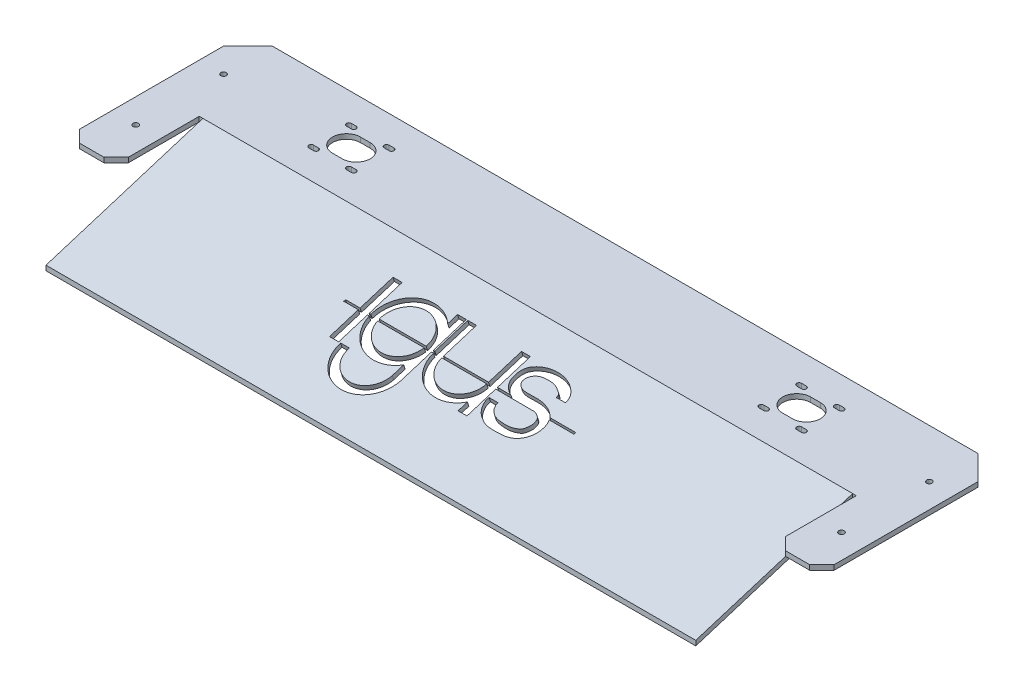
from build123d import *

# Parameters (mm, degrees)
BOSS_EXTRUDE1_DEPTH  = 4
MIRROR6_COPY_1_DEPTH = 4
MIRROR6_COPY_2_DEPTH = 4
SKETCH2_R            = 2.25
CUT_EXTRUDE1_DEPTH   = 44
CHAMFER1_SIZE        = 10
CHAMFER2_SIZE        = 10
SKETCH3_W            = 4.89133335
SKETCH3_H            = 7.534428505
SKETCH3_W_2          = 4.722258617
SKETCH3_W_3          = 4.986234694
SKETCH3_R            = 2.398576227
CUT_EXTRUDE2_DEPTH   = 10
CUT_EXTRUDE3_DEPTH   = 10
BOSS_EXTRUDE2_DEPTH  = 267
CUT_EXTRUDE4_DEPTH   = 494
SKETCH8_W            = 234.885891169
SKETCH8_H            = 80
BOSS_EXTRUDE3_DEPTH  = 4
SKETCH9_W            = 791.232351343
SKETCH9_H            = 194.819885891
CUT_EXTRUDE5_DEPTH   = 139
CHAMFER3_SIZE        = 20


with BuildPart() as part:
    # Sketch1 → Boss-Extrude1 (new body)
    with BuildSketch(Plane(origin=(0, 0, 0), x_dir=(1, 0, 0), z_dir=(0, 1, 0))):
        with BuildLine():
            Line((-310, 108.284271247), (-310, 0))
            Line((-310, 0), (-200.5, 0))
            ThreePointArc((-200.5, 0), (-197.131727984, 8.131727984), (-189, 11.5))
            Line((-189, 11.5), (-181, 11.5))
            ThreePointArc((-181, 11.5), (-172.868272016, 8.131727984), (-169.5, 0))
            Line((-169.5, 0), (0, 0))
            Line((0, 0), (0, 40))
            Line((0, 40), (-241.715728753, 40))
            Line((-241.715728753, 40), (-270, 68.284271247))
            Line((-270, 68.284271247), (-270, 108.284271247))
            Line((-270, 108.284271247), (-310, 108.284271247))
        make_face()
        with BuildLine():
            ThreePointArc((-202.499780644, 13.499780644), (-204.499780644, 15.499780644), (-202.499780644, 17.499780644))
            Line((-202.499780644, 17.499780644), (-198.499780644, 17.499780644))
            ThreePointArc((-198.499780644, 17.499780644), (-196.499780644, 15.499780644), (-198.499780644, 13.499780644))
            Line((-198.499780644, 13.499780644), (-202.499780644, 13.499780644))
        make_face(mode=Mode.SUBTRACT)
        with BuildLine():
            Line((-171.500219356, 17.499780644), (-167.500219356, 17.499780644))
            ThreePointArc((-167.500219356, 17.499780644), (-165.500219356, 15.499780644), (-167.500219356, 13.499780644))
            Line((-167.500219356, 13.499780644), (-171.500219356, 13.499780644))
            ThreePointArc((-171.500219356, 13.499780644), (-173.500219356, 15.499780644), (-171.500219356, 17.499780644))
        make_face(mode=Mode.SUBTRACT)
    boss_extrude1 = extrude(amount=BOSS_EXTRUDE1_DEPTH)

    # Mirror1: Boss-Extrude1 across plane
    add(boss_extrude1.mirror(Plane(origin=(0, 4, 0), x_dir=(1, 0, 0), z_dir=(0, 0, -1))))

    # Mirror5: Boss-Extrude1 across plane
    add(boss_extrude1.mirror(Plane(origin=(0, 4, 0), x_dir=(0, 0, 1), z_dir=(1, 0, 0))))

    # Mirror6 copy 1 sketch → Mirror6 copy 1 (add)
    with BuildSketch(Plane(origin=(0, 0, 0), x_dir=(-1, 0, 0), z_dir=(0, 1, 0))):
        with BuildLine():
            Line((-310, 108.284271247), (-310, 0))
            Line((-310, 0), (-200.5, 0))
            ThreePointArc((-200.5, 0), (-197.131727984, 8.131727984), (-189, 11.5))
            Line((-189, 11.5), (-181, 11.5))
            ThreePointArc((-181, 11.5), (-172.868272016, 8.131727984), (-169.5, 0))
            Line((-169.5, 0), (0, 0))
            Line((0, 0), (0, 40))
            Line((0, 40), (-241.715728753, 40))
            Line((-241.715728753, 40), (-270, 68.284271247))
            Line((-270, 68.284271247), (-270, 108.284271247))
            Line((-270, 108.284271247), (-310, 108.284271247))
        make_face()
        with BuildLine():
            ThreePointArc((-202.499780644, 13.499780644), (-204.499780644, 15.499780644), (-202.499780644, 17.499780644))
            Line((-202.499780644, 17.499780644), (-198.499780644, 17.499780644))
            ThreePointArc((-198.499780644, 17.499780644), (-196.499780644, 15.499780644), (-198.499780644, 13.499780644))
            Line((-198.499780644, 13.499780644), (-202.499780644, 13.499780644))
        make_face(mode=Mode.SUBTRACT)
        with BuildLine():
            Line((-171.500219356, 17.499780644), (-167.500219356, 17.499780644))
            ThreePointArc((-167.500219356, 17.499780644), (-165.500219356, 15.499780644), (-167.500219356, 13.499780644))
            Line((-167.500219356, 13.499780644), (-171.500219356, 13.499780644))
            ThreePointArc((-171.500219356, 13.499780644), (-173.500219356, 15.499780644), (-171.500219356, 17.499780644))
        make_face(mode=Mode.SUBTRACT)
    extrude(amount=MIRROR6_COPY_1_DEPTH)

    # Mirror6 copy 2 sketch → Mirror6 copy 2 (add)
    with BuildSketch(Plane(origin=(0, 0, 0), x_dir=(1, 0, 0), z_dir=(0, 1, 0))):
        with BuildLine():
            Line((-310, -108.284271247), (-310, 0))
            Line((-310, 0), (-200.5, 0))
            ThreePointArc((-200.5, 0), (-197.131727984, -8.131727984), (-189, -11.5))
            Line((-189, -11.5), (-181, -11.5))
            ThreePointArc((-181, -11.5), (-172.868272016, -8.131727984), (-169.5, 0))
            Line((-169.5, 0), (0, 0))
            Line((0, 0), (0, -40))
            Line((0, -40), (-241.715728753, -40))
            Line((-241.715728753, -40), (-270, -68.284271247))
            Line((-270, -68.284271247), (-270, -108.284271247))
            Line((-270, -108.284271247), (-310, -108.284271247))
        make_face()
        with BuildLine():
            ThreePointArc((-202.499780644, -13.499780644), (-204.499780644, -15.499780644), (-202.499780644, -17.499780644))
            Line((-202.499780644, -17.499780644), (-198.499780644, -17.499780644))
            ThreePointArc((-198.499780644, -17.499780644), (-196.499780644, -15.499780644), (-198.499780644, -13.499780644))
            Line((-198.499780644, -13.499780644), (-202.499780644, -13.499780644))
        make_face(mode=Mode.SUBTRACT)
        with BuildLine():
            Line((-171.500219356, -17.499780644), (-167.500219356, -17.499780644))
            ThreePointArc((-167.500219356, -17.499780644), (-165.500219356, -15.499780644), (-167.500219356, -13.499780644))
            Line((-167.500219356, -13.499780644), (-171.500219356, -13.499780644))
            ThreePointArc((-171.500219356, -13.499780644), (-173.500219356, -15.499780644), (-171.500219356, -17.499780644))
        make_face(mode=Mode.SUBTRACT)
    extrude(amount=MIRROR6_COPY_2_DEPTH)

    # Sketch2 → Cut-Extrude1 (cut)
    with BuildSketch(Plane(origin=(0, 4, 0), x_dir=(1, 0, 0), z_dir=(0, 1, 0))):
        with BuildLine():
            ThreePointArc((-287.75, -72.189514165), (-288.409009742, -70.598523907), (-290, -69.939514165))
            Line((-290, -69.939514165), (-290, -72.189514165))
            Line((-290, -72.189514165), (-290, -74.439514165))
            ThreePointArc((-290, -74.439514165), (-288.409009742, -73.780504423), (-287.75, -72.189514165))
        make_face()
        with BuildLine():
            Line((-290, -72.189514165), (-290, -69.939514165))
            ThreePointArc((-290, -69.939514165), (-292.25, -72.189514165), (-290, -74.439514165))
            Line((-290, -74.439514165), (-290, -72.189514165))
        make_face()
        with Locations(Location((-290, 0, 0), (0, 0, 270))):
            Circle(SKETCH2_R)
        with BuildLine():
            ThreePointArc((-290, 74.439514165), (-292.25, 72.189514165), (-290, 69.939514165))
            Line((-290, 69.939514165), (-290, 72.189514165))
            Line((-290, 72.189514165), (-290, 74.439514165))
        make_face()
        with BuildLine():
            Line((-290, 72.189514165), (-290, 69.939514165))
            ThreePointArc((-290, 69.939514165), (-288.409009742, 70.598523907), (-287.75, 72.189514165))
            ThreePointArc((-287.75, 72.189514165), (-288.409009742, 73.780504423), (-290, 74.439514165))
            Line((-290, 74.439514165), (-290, 72.189514165))
        make_face()
    cut_extrude1 = extrude(amount=-CUT_EXTRUDE1_DEPTH, mode=Mode.SUBTRACT)

    # Chamfer1
    chamfer1_edges = [part.edges().sort_by_distance(p)[0] for p in [
        (-310, 2, -108.284271247),
        (-270, 2, -108.284271247),
        (-310, 2, 108.284271247),
        (-270, 2, 108.284271247),
    ]]
    chamfer(chamfer1_edges, length=CHAMFER1_SIZE)

    # Mirror9: Cut-Extrude1 across plane
    add(cut_extrude1.mirror(Plane(origin=(0, 0, 0), x_dir=(0, 0, 1), z_dir=(1, 0, 0))), mode=Mode.SUBTRACT)

    # Chamfer2
    chamfer2_edges = [part.edges().sort_by_distance(p)[0] for p in [
        (310, 2, -108.284271247),
        (270, 2, -108.284271247),
        (270, 2, 108.284271247),
        (310, 2, 108.284271247),
    ]]
    chamfer(chamfer2_edges, length=CHAMFER2_SIZE)

    # Sketch3 → Cut-Extrude2 (cut)
    # profile 1 of 9: a face of its own
    with BuildSketch(Plane(origin=(0, 4, 0), x_dir=(1, 0, 0), z_dir=(0, 1, 0))):
        with BuildLine():
            Line((17.756292578, 19.05072103), (13.034033961, 19.05072103))
            Line((13.034033961, 19.05072103), (13.034033961, 7.690043412))
            Line((13.034033961, 7.690043412), (12.186922475, 7.690043412))
            Line((12.186922475, 7.690043412), (12.186922475, 6.673634872))
            Line((12.186922475, 6.673634872), (13.225704841, 6.673634872))
            ThreePointArc((13.225704841, 6.673634872), (24.116047648, -8.695675291), (42.460223463, -4.417068623))
            Line((42.460223463, -4.417068623), (42.460223463, -9.82377172))
            Line((42.460223463, -9.82377172), (47.351556813, -9.82377172))
            Line((47.351556813, -9.82377172), (47.351556813, 6.673634872))
            Line((47.351556813, 6.673634872), (69.025260991, 6.577857233))
            add(Edge.make_bspline(
                [(53.065115514, 1.992023577), (52.881837045, 1.062447323), (53.465286783, -0.024014), (54.104109076, -1.49188122), (54.980355207, -2.267471592), (55.990558487, -3.253822675), (57.452703304, -4.003429754), (59.394774923, -4.52432428), (61.614526466, -4.708300775), (64.133123091, -4.769461908), (66.61763139, -4.538941365), (68.828544546, -3.78251384), (70.965531795, -2.816690556), (71.985481287, -0.789058617), (72.789638663, 1.157030101), (72.696348399, 3.064497119), (72.029797832, 5.473319111), (69.935664737, 6.048250566), (69.025260991, 6.577857233)],
                knots=[0, 0, 0, 0, 0.081184108, 0.10790483, 0.143900876, 0.185103716, 0.23586594, 0.290215762, 0.366526158, 0.436729253, 0.51873906, 0.590001951, 0.649430214, 0.723575416, 0.786665555, 0.838093389, 0.894821875, 1, 1, 1, 1], degree=3))
            Line((53.065115514, 1.992023577), (48.176767212, 1.992023577))
            add(Edge.make_bspline(
                [(76.689802119, 6.673634872), (76.776720841, 6.515309476), (77.346082491, 5.379089539), (77.842385043, 2.775098219), (77.495708471, -0.969732888), (75.84192986, -4.323913716), (73.376942523, -6.987464077), (70.475703458, -8.580791803), (67.383864983, -9.28319435), (63.916433002, -9.449948165), (60.249662271, -9.506502989), (56.621049626, -9.147945731), (53.7606345, -7.582775153), (51.081460509, -5.941045539), (48.808288636, -2.537264498), (47.91057008, 0.166586441), (48.176767212, 1.992023577)],
                knots=[0.511379909, 0.511379909, 0.511379909, 0.511379909, 0.516990878, 0.550897762, 0.592186626, 0.63231135, 0.665073685, 0.704086852, 0.733344431, 0.763283971, 0.812029986, 0.848328531, 0.874618577, 0.91298076, 0.944693495, 1, 1, 1, 1], degree=3))
            Line((76.689802119, 6.673634872), (82.483953867, 6.673634872))
            Line((82.483953867, 6.673634872), (82.483953867, 7.690043412))
            Line((82.483953867, 7.690043412), (76.019711163, 7.690043412))
            add(Edge.make_bspline(
                [(54.711643622, 19.05072103), (54.228336507, 18.492948034), (53.432038562, 17.131039988), (53.374474987, 14.851467964), (54.797016983, 13.113774771), (58.599264933, 11.576030604), (64.211750858, 12.572849086), (70.285584626, 11.558006557), (74.079668595, 9.742953229), (75.581729127, 8.253961347), (76.019711163, 7.690043412)],
                knots=[0.197684265, 0.197684265, 0.197684265, 0.197684265, 0.220521746, 0.245718615, 0.26280001, 0.287259547, 0.369622478, 0.434467432, 0.476788021, 0.498807658, 0.498807658, 0.498807658, 0.498807658], degree=3))
            Line((54.711643622, 19.05072103), (49.132787671, 19.05072103))
            add(Edge.make_bspline(
                [(49.132787671, 19.05072103), (48.839053253, 17.885586508), (48.737005594, 15.70465507), (49.393762237, 11.111054491), (52.39797666, 8.519920076), (54.705573707, 7.690043412)],
                knots=[0.713647859, 0.713647859, 0.713647859, 0.713647859, 0.787926735, 0.842679623, 1, 1, 1, 1], degree=3))
            Line((54.705573707, 7.690043412), (47.351556813, 7.690043412))
            Line((47.351556813, 7.690043412), (47.351556813, 19.05072103))
            Line((47.351556813, 19.05072103), (42.460223463, 19.05072103))
            Line((42.460223463, 19.05072103), (42.460223463, 7.690043412))
            Line((42.460223463, 7.690043412), (17.756292578, 7.690043412))
            Line((17.756292578, 7.690043412), (17.756292578, 19.05072103))
        make_face()
        with BuildLine():
            ThreePointArc((42.453173513, 6.673634872), (30.105024404, -5.264242546), (17.756875295, 6.673634872))
            Line((17.756875295, 6.673634872), (42.453173513, 6.673634872))
        make_face(mode=Mode.SUBTRACT)
    # profile 2 of 9: a face of its own
    with BuildSketch(Plane(origin=(0, 4, 0), x_dir=(1, 0, 0), z_dir=(0, 1, 0))):
        with BuildLine():
            Line((-22.946213844, 19.05072103), (-27.932448538, 19.05072103))
            Line((-27.932448538, 19.05072103), (-27.932448538, 7.690043412))
            Line((-27.932448538, 7.690043412), (-35.931837929, 7.690043412))
            Line((-35.931837929, 7.690043412), (-35.931837929, 6.673634872))
            Line((-35.931837929, 6.673634872), (-27.932448538, 6.673634872))
            Line((-27.932448538, 6.673634872), (-27.932448538, -9.82377172))
            Line((-27.932448538, -9.82377172), (-22.946213844, -9.82377172))
            Line((-22.946213844, -9.82377172), (-22.946213844, 6.673634872))
            Line((-22.946213844, 6.673634872), (-21.948820324, 6.673634872))
            ThreePointArc((-21.948820324, 6.673634872), (-10.703931008, -8.020841554), (7.425571711, -4.319989716))
            Line((7.425571711, -4.319989716), (7.425571711, -10.878511442))
            ThreePointArc((7.425571711, -10.878511442), (-5.357108304, -22.606451736), (-17.085048598, -9.82377172))
            Line((-17.085048598, -9.82377172), (-21.846399362, -9.82377172))
            ThreePointArc((-21.846399362, -9.82377172), (-5.357108304, -27.3678025), (12.186922475, -10.878511442))
            Line((12.186922475, -10.878511442), (12.186922475, 6.673634872))
            Line((12.186922475, 6.673634872), (12.186922475, 7.690043412))
            Line((12.186922475, 7.690043412), (12.186922475, 19.05072103))
            Line((12.186922475, 19.05072103), (2.513227227, 19.05072103))
            ThreePointArc((2.513227227, 19.05072103), (6.896441183, 14.132295136), (8.275161815, 7.690043412))
            Line((8.275161815, 7.690043412), (-17.463188566, 7.690043412))
            ThreePointArc((-17.463188566, 7.690043412), (-16.084467934, 14.132295136), (-11.701253978, 19.05072103))
            Line((-11.701253978, 19.05072103), (-18.318763594, 19.05072103))
            ThreePointArc((-18.318763594, 19.05072103), (-21.170258302, 13.696875268), (-22.01444878, 7.690043412))
            Line((-22.01444878, 7.690043412), (-22.946213844, 7.690043412))
            Line((-22.946213844, 7.690043412), (-22.946213844, 19.05072103))
        make_face()
        with BuildLine():
            ThreePointArc((8.186183206, 6.673634872), (-4.594013375, -4.579297807), (-17.374209956, 6.673634872))
            Line((-17.374209956, 6.673634872), (8.186183206, 6.673634872))
        make_face(mode=Mode.SUBTRACT)
    # profile 3 of 9: a face of its own
    with BuildSketch(Plane(origin=(0, 4, 0), x_dir=(1, 0, 0), z_dir=(0, 1, 0))):
        with BuildLine():
            add(Edge.make_bspline(
                [(75.926908033, 16.711887446), (75.98198398, 17.533071739), (75.87815744, 18.314387372), (75.647457481, 19.05072103)],
                knots=[0, 0, 0, 0, 0.048614378, 0.048614378, 0.048614378, 0.048614378], degree=3))
            Line((75.647457481, 19.05072103), (69.828511328, 19.05072103))
            add(Edge.make_bspline(
                [(70.902358123, 16.711887446), (71.166450288, 17.527072406), (70.619011269, 18.36228737), (69.932996585, 18.965212767), (69.828511328, 19.05072103)],
                knots=[0, 0, 0, 0, 0.023973978, 0.028160225, 0.028160225, 0.028160225, 0.028160225], degree=3))
            Line((70.902358123, 16.711887446), (75.926908033, 16.711887446))
        make_face()
    # profile 4 of 9: a face of its own
    with BuildSketch(Plane(origin=(0, 4, 0), x_dir=(1, 0, 0), z_dir=(0, 1, 0))):
        with BuildLine():
            add(Edge.make_bspline(
                [(75.647457481, 19.05072103), (74.8610236, 21.560811367), (70.159759986, 25.693522362), (61.769498524, 27.189063275), (54.345606328, 25.369162718), (50.102002584, 21.86707642), (49.281229323, 19.639533517), (49.132787671, 19.05072103)],
                knots=[0.048614378, 0.048614378, 0.048614378, 0.048614378, 0.214336098, 0.393230308, 0.565847142, 0.676110279, 0.713647859, 0.713647859, 0.713647859, 0.713647859], degree=3))
            Line((49.132787671, 19.05072103), (54.711643622, 19.05072103))
            add(Edge.make_bspline(
                [(69.828511328, 19.05072103), (69.460610839, 19.351802088), (68.44441553, 19.988567659), (66.290510676, 21.191963116), (63.448419319, 21.636606986), (60.184054731, 21.526555102), (57.263617202, 21.092430186), (55.428580667, 19.838629095), (54.781454546, 19.131288121), (54.711643622, 19.05072103)],
                knots=[0.028160225, 0.028160225, 0.028160225, 0.028160225, 0.04290032, 0.065706797, 0.10450496, 0.130316026, 0.168033853, 0.194385522, 0.197684265, 0.197684265, 0.197684265, 0.197684265], degree=3))
            Line((69.828511328, 19.05072103), (75.647457481, 19.05072103))
        make_face()
    # profile 5 of 9: a face of its own
    with BuildSketch(Plane(origin=(0, 4, 0), x_dir=(1, 0, 0), z_dir=(0, 1, 0))):
        with Locations((44.905890138, 22.817935283)):
            Rectangle(SKETCH3_W, SKETCH3_H)
    # profile 6 of 9: a face of its own
    with BuildSketch(Plane(origin=(0, 4, 0), x_dir=(1, 0, 0), z_dir=(0, 1, 0))):
        with Locations((15.395163269, 22.817935283)):
            Rectangle(SKETCH3_W_2, SKETCH3_H)
    # profile 7 of 9: a face of its own
    with BuildSketch(Plane(origin=(0, 4, 0), x_dir=(1, 0, 0), z_dir=(0, 1, 0))):
        with BuildLine():
            ThreePointArc((7.425571711, 20.929069677), (-5.862455507, 25.689597653), (-18.318763594, 19.05072103))
            Line((-18.318763594, 19.05072103), (-11.701253978, 19.05072103))
            ThreePointArc((-11.701253978, 19.05072103), (-4.594013375, 21.188377767), (2.513227227, 19.05072103))
            Line((2.513227227, 19.05072103), (12.186922475, 19.05072103))
            Line((12.186922475, 19.05072103), (12.186922475, 26.585149535))
            Line((12.186922475, 26.585149535), (7.425571711, 26.585149535))
            Line((7.425571711, 26.585149535), (7.425571711, 20.929069677))
        make_face()
    # profile 8 of 9: a face of its own
    with BuildSketch(Plane(origin=(0, 4, 0), x_dir=(1, 0, 0), z_dir=(0, 1, 0))):
        with Locations((-25.439331191, 22.817935283)):
            Rectangle(SKETCH3_W_3, SKETCH3_H)
    # profile 9 of 9: a face of its own
    with BuildSketch(Plane(origin=(0, 4, 0), x_dir=(1, 0, 0), z_dir=(0, 1, 0))):
        with Locations(Location((-25.580451041, 32.418103328, 0), (0, 0, 270))):
            Circle(SKETCH3_R)
    extrude(amount=-CUT_EXTRUDE2_DEPTH, mode=Mode.SUBTRACT)


with BuildPart() as cut_extrude2_piece_1:
    # of the separate pieces the step leaves, piece 1, a body of its own (cut_extrude2_pieces)
    add(part.part.solids().sort_by_distance((270, 0, -98.284271247))[0])

    # Sketch5 → Cut-Extrude3 (cut)
    with BuildSketch(Plane(origin=(0, 4, 0), x_dir=(1, 0, 0), z_dir=(0, 1, 0))):
        Polygon((-270, -68.284271247), (-241.715728753, -40), (-270, -40), align=None)
        Polygon((241.715728753, -40), (270, -68.284271247), (270, -40), align=None)
    extrude(amount=-CUT_EXTRUDE3_DEPTH, mode=Mode.SUBTRACT)

    # Sketch6 → Boss-Extrude2 (add, symmetric)
    with BuildSketch(Plane(origin=(0, 0, 0), x_dir=(0, 0, -1), z_dir=(1, 0, 0))):
        Polygon((-40, 4), (-168.937969582, -36), (-168.937969582, -40), (-40, 0), align=None)
    extrude(amount=BOSS_EXTRUDE2_DEPTH, both=True)

    # Sketch7 → Cut-Extrude4 (cut)
    # profile 1 of 2: a face of its own
    with BuildSketch(Plane(origin=(0, 14.968491157, 4.643625522), x_dir=(1, 0, 0), z_dir=(0, 0.9550960709798243, 0.29629629629629645))):
        with BuildLine():
            Line((-76.620361052, -94.775659486), (-75.124270772, -94.775659486))
            ThreePointArc((-75.124270772, -94.775659486), (-58.256936797, -116.817374125), (-31.062682719, -111.266096368))
            Line((-31.062682719, -111.266096368), (-31.062682719, -121.103878957))
            ThreePointArc((-31.062682719, -121.103878957), (-50.236702742, -138.695789398), (-67.828613183, -119.521769375))
            Line((-67.828613183, -119.521769375), (-74.970639329, -119.521769375))
            ThreePointArc((-74.970639329, -119.521769375), (-50.236702742, -145.837815544), (-23.920656573, -121.103878957))
            Line((-23.920656573, -121.103878957), (-23.920656573, -64.908387492))
            Line((-23.920656573, -64.908387492), (-31.062682719, -64.908387492))
            Line((-31.062682719, -64.908387492), (-31.062682719, -73.392507279))
            ThreePointArc((-31.062682719, -73.392507279), (-59.815775322, -68.482654627), (-75.222713455, -93.251046677))
            Line((-75.222713455, -93.251046677), (-76.620361052, -93.251046677))
            Line((-76.620361052, -93.251046677), (-76.620361052, -64.908387491))
            Line((-76.620361052, -64.908387491), (-84.099713093, -64.908387491))
            Line((-84.099713093, -64.908387491), (-84.099713093, -93.251046677))
            Line((-84.099713093, -93.251046677), (-96.098797179, -93.251046677))
            Line((-96.098797179, -93.251046677), (-96.098797179, -94.775659486))
            Line((-96.098797179, -94.775659486), (-84.099713093, -94.775659486))
            Line((-84.099713093, -94.775659486), (-84.099713093, -119.521769375))
            Line((-84.099713093, -119.521769375), (-76.620361052, -119.521769375))
            Line((-76.620361052, -119.521769375), (-76.620361052, -94.775659486))
        make_face()
        with BuildLine():
            ThreePointArc((-29.788297563, -93.251046677), (-49.092060349, -73.003545143), (-68.395823135, -93.251046677))
            Line((-68.395823135, -93.251046677), (-29.788297563, -93.251046677))
        make_face(mode=Mode.SUBTRACT)
        with BuildLine():
            ThreePointArc((-68.26235522, -94.775659486), (-49.092060349, -111.655058504), (-29.921765477, -94.775659486))
            Line((-29.921765477, -94.775659486), (-68.26235522, -94.775659486))
        make_face(mode=Mode.SUBTRACT)
    # profile 2 of 2: a face of its own
    with BuildSketch(Plane(origin=(0, 14.968491157, 4.643625522), x_dir=(1, 0, 0), z_dir=(0, 0.9550960709798243, 0.29629629629629645))):
        with BuildLine():
            Line((-23.920656573, -93.251046677), (-23.920656573, -94.775659486))
            Line((-23.920656573, -94.775659486), (-22.362483025, -94.775659486))
            ThreePointArc((-22.362483025, -94.775659486), (-6.026968814, -117.829624731), (21.489294908, -111.411714729))
            Line((21.489294908, -111.411714729), (21.489294908, -119.521769375))
            Line((21.489294908, -119.521769375), (28.826294934, -119.521769375))
            Line((28.826294934, -119.521769375), (28.826294934, -94.775659487))
            Line((28.826294934, -94.775659487), (61.3368512, -94.919325946))
            add(Edge.make_bspline(
                [(37.396632985, -101.798076429), (37.121715281, -103.19244081), (37.996889889, -104.822132794), (38.955123328, -107.023933625), (40.269492526, -108.187319182), (41.784797445, -109.666845807), (43.978014671, -110.791256425), (46.891122099, -111.572598214), (50.220749413, -111.848562957), (53.99864435, -111.940304656), (57.7254068, -111.594523842), (61.041776534, -110.459882554), (64.247257408, -109.011147629), (65.777181645, -105.969699719), (66.983417709, -103.050566642), (66.843482312, -100.189366116), (65.843656462, -96.576133129), (62.70245682, -95.713735945), (61.3368512, -94.919325946)],
                knots=[0, 0, 0, 0, 0.081184108, 0.10790483, 0.143900876, 0.185103716, 0.23586594, 0.290215762, 0.366526158, 0.436729253, 0.51873906, 0.590001951, 0.649430214, 0.723575416, 0.786665555, 0.838093389, 0.894821875, 1, 1, 1, 1], degree=3))
            Line((37.396632985, -101.798076429), (30.064110533, -101.798076429))
            add(Edge.make_bspline(
                [(72.833662893, -94.775659486), (72.964040976, -95.013147581), (73.818083451, -96.717477486), (74.56253728, -100.623464466), (74.042522421, -106.240711126), (71.561854504, -111.271982369), (67.864373499, -115.26730791), (63.512514902, -117.657299499), (58.874757189, -118.71090332), (53.673609218, -118.961034042), (48.17345312, -119.045866279), (42.730534153, -118.508030392), (38.439911464, -116.160274525), (34.421150478, -113.697680102), (31.011392668, -108.592008542), (29.664814834, -104.536232133), (30.064110533, -101.798076429)],
                knots=[0.511379909, 0.511379909, 0.511379909, 0.511379909, 0.516990878, 0.550897762, 0.592186626, 0.63231135, 0.665073685, 0.704086852, 0.733344431, 0.763283971, 0.812029986, 0.848328531, 0.874618577, 0.91298076, 0.944693495, 1, 1, 1, 1], degree=3))
            Line((72.833662893, -94.775659486), (93.142300858, -94.775659486))
            Line((93.142300858, -94.775659486), (93.142300858, -93.251046677))
            Line((93.142300858, -93.251046677), (71.828526459, -93.251046677))
            add(Edge.make_bspline(
                [(64.152496899, -79.718280625), (64.548635146, -78.495503186), (63.297652127, -76.586907522), (60.642742168, -74.902239853), (57.234725728, -72.99816712), (52.971588693, -72.331201315), (48.075041811, -72.496279142), (43.694385517, -73.147466516), (40.008729011, -75.665716185), (37.951391785, -78.916328253), (37.860672194, -82.508909849), (39.994485189, -85.115449637), (45.697857114, -87.422065889), (54.116586002, -85.926838165), (63.227336653, -87.449101958), (68.918462607, -90.171681951), (71.171553404, -92.405169774), (71.828526459, -93.251046677)],
                knots=[0, 0, 0, 0, 0.023973978, 0.04290032, 0.065706797, 0.10450496, 0.130316026, 0.168033853, 0.194385522, 0.220521746, 0.245718615, 0.26280001, 0.287259547, 0.369622478, 0.434467432, 0.476788021, 0.498807658, 0.498807658, 0.498807658, 0.498807658], degree=3))
            Line((64.152496899, -79.718280625), (71.689321764, -79.718280625))
            add(Edge.make_bspline(
                [(71.689321764, -79.718280625), (72.053558559, -74.287497246), (64.221492684, -66.456675657), (50.453207501, -64.002516883), (39.317369206, -66.732367717), (31.476341618, -73.203272387), (30.775327872, -80.325874297), (31.889603071, -88.119530058), (36.395924704, -92.00623168), (39.857320275, -93.251046677)],
                knots=[0, 0, 0, 0, 0.214336098, 0.393230308, 0.565847142, 0.676110279, 0.787926735, 0.842679623, 1, 1, 1, 1], degree=3))
            Line((39.857320275, -93.251046677), (28.826294934, -93.251046677))
            Line((28.826294934, -93.251046677), (28.826294934, -64.908387491))
            Line((28.826294934, -64.908387491), (21.489294908, -64.908387491))
            Line((21.489294908, -64.908387491), (21.489294908, -93.251046677))
            Line((21.489294908, -93.251046677), (-15.566601419, -93.251046677))
            Line((-15.566601419, -93.251046677), (-15.566601419, -64.908387492))
            Line((-15.566601419, -64.908387492), (-22.649989344, -64.908387492))
            Line((-22.649989344, -64.908387492), (-22.649989344, -93.251046677))
            Line((-22.649989344, -93.251046677), (-23.920656573, -93.251046677))
        make_face()
        with BuildLine():
            ThreePointArc((21.478719984, -94.775659486), (2.956496321, -112.682475613), (-15.565727342, -94.775659486))
            Line((-15.565727342, -94.775659486), (21.478719984, -94.775659486))
        make_face(mode=Mode.SUBTRACT)
    extrude(amount=-CUT_EXTRUDE4_DEPTH, mode=Mode.SUBTRACT)


with BuildPart() as cut_extrude2_piece_2:
    # of the separate pieces the step leaves, piece 2, a body of its own (cut_extrude2_pieces)
    add(part.part.solids().sort_by_distance((8.275161815, 0, -7.690043412))[0])



with BuildPart() as cut_extrude2_piece_3:
    # of the separate pieces the step leaves, piece 3, a body of its own (cut_extrude2_pieces)
    add(part.part.solids().sort_by_distance((17.756875295, 0, -6.673634872))[0])


with BuildPart() as cut_extrude2_piece_4:
    # of the separate pieces the step leaves, piece 4, a body of its own (cut_extrude2_pieces)
    add(part.part.solids().sort_by_distance((-17.374209956, 0, -6.673634872))[0])


with BuildPart() as cut_extrude4_piece_1:
    # of the separate pieces the step leaves, piece 1, a body of its own (cut_extrude4_pieces)
    add(cut_extrude2_piece_1.part.solids().sort_by_distance((270, 0, -98.284271247))[0])


with BuildPart() as cut_extrude4_piece_2:
    # of the separate pieces the step leaves, piece 2, a body of its own (cut_extrude4_pieces)
    add(cut_extrude2_piece_1.part.solids().sort_by_distance((-29.788297563, -16.310282619, 92.575368104))[0])


with BuildPart() as cut_extrude4_piece_3:
    # of the separate pieces the step leaves, piece 3, a body of its own (cut_extrude4_pieces)
    add(cut_extrude2_piece_1.part.solids().sort_by_distance((-15.565727342, -16.762019747, 94.031519808))[0])


with BuildPart() as cut_extrude4_piece_4:
    # of the separate pieces the step leaves, piece 4, a body of its own (cut_extrude4_pieces)
    add(cut_extrude2_piece_1.part.solids().sort_by_distance((-68.26235522, -16.762019747, 94.031519808))[0])


with BuildPart() as cut_extrude2_piece_2_1:
    add(cut_extrude2_piece_2.part)

    add(cut_extrude2_piece_3.part)  # Boss-Extrude3 merges Cut-Extrude2 piece 3

    add(cut_extrude2_piece_4.part)  # Boss-Extrude3 merges Cut-Extrude2 piece 4

    add(cut_extrude4_piece_1.part)  # Boss-Extrude3 merges Cut-Extrude4 piece 1
    # Sketch8 → Boss-Extrude3 (add)
    with BuildSketch(Plane(origin=(0, 4, 0), x_dir=(1, 0, 0), z_dir=(0, 1, 0))):
        with Locations((-0.257866374, 0)):
            Rectangle(SKETCH8_W, SKETCH8_H)
    extrude(amount=-BOSS_EXTRUDE3_DEPTH)

    # Sketch9 → Cut-Extrude5 (cut)
    with BuildSketch(Plane(origin=(0, 4, 0), x_dir=(1, 0, 0), z_dir=(0, 1, 0))):
        with Locations((3.778514768, 137.409942946)):
            Rectangle(SKETCH9_W, SKETCH9_H)
    extrude(amount=-CUT_EXTRUDE5_DEPTH, mode=Mode.SUBTRACT)

    # Chamfer3
    chamfer3_edges = [cut_extrude2_piece_2_1.edges().sort_by_distance(p)[0] for p in [
        (-310, 2, -40),
        (310, 2, -40),
    ]]
    chamfer(chamfer3_edges, length=CHAMFER3_SIZE)


solid = Compound([cut_extrude4_piece_2.part, cut_extrude4_piece_3.part, cut_extrude4_piece_4.part, cut_extrude2_piece_2_1.part])
